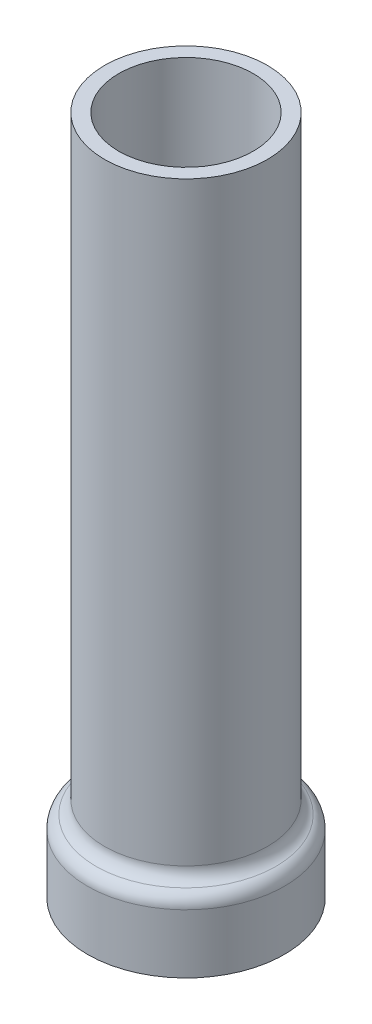
from build123d import *

# Parameters (mm, degrees)
SKETCH1_R           = 17.653
SKETCH1_R_2         = 15.113
BOSS_EXTRUDE1_DEPTH = 6.35
SKETCH2_R           = 17.653
SKETCH2_R_2         = 12.065
BOSS_EXTRUDE2_DEPTH = 6.35
SKETCH3_R           = 14.605
SKETCH3_R_2         = 12.065
BOSS_EXTRUDE3_DEPTH = 109.22
FILLET1_R           = 2.54
FILLET2_R           = 2.54


with BuildPart() as part:
    # Sketch1 → Boss-Extrude1 (new body)
    with BuildSketch(Plane(origin=(0, 0, 0), x_dir=(1, 0, 0), z_dir=(0, 1, 0))):
        with Locations(Location((0, 0, 0), (0, 0, 270))):
            Circle(SKETCH1_R)
        with Locations(Location((0, 0, 0), (0, 0, 270))):
            Circle(SKETCH1_R_2, mode=Mode.SUBTRACT)
    extrude(amount=BOSS_EXTRUDE1_DEPTH)

    # Sketch2 → Boss-Extrude2 (add)
    with BuildSketch(Plane(origin=(0, 6.35, 0), x_dir=(1, 0, 0), z_dir=(0, 1, 0))):
        with Locations(Location((0, 0, 0), (0, 0, 270))):
            Circle(SKETCH2_R)
        with Locations(Location((0, 0, 0), (0, 0, 270))):
            Circle(SKETCH2_R_2, mode=Mode.SUBTRACT)
    extrude(amount=BOSS_EXTRUDE2_DEPTH)

    # Sketch3 → Boss-Extrude3 (add)
    with BuildSketch(Plane(origin=(0, 12.7, 0), x_dir=(1, 0, 0), z_dir=(0, 1, 0))):
        with Locations(Location((0, 0, 0), (0, 0, 270))):
            Circle(SKETCH3_R)
        with Locations(Location((0, 0, 0), (0, 0, 270))):
            Circle(SKETCH3_R_2, mode=Mode.SUBTRACT)
    extrude(amount=BOSS_EXTRUDE3_DEPTH)

    # Fillet1
    fillet1_edges = [part.edges().sort_by_distance(p)[0] for p in [
        (0, 12.7, -14.605),
    ]]
    fillet(fillet1_edges, radius=FILLET1_R)

    # Fillet2
    fillet2_edges = [part.edges().sort_by_distance(p)[0] for p in [
        (0, 12.7, -17.653),
    ]]
    fillet(fillet2_edges, radius=FILLET2_R)


solid = part.part
